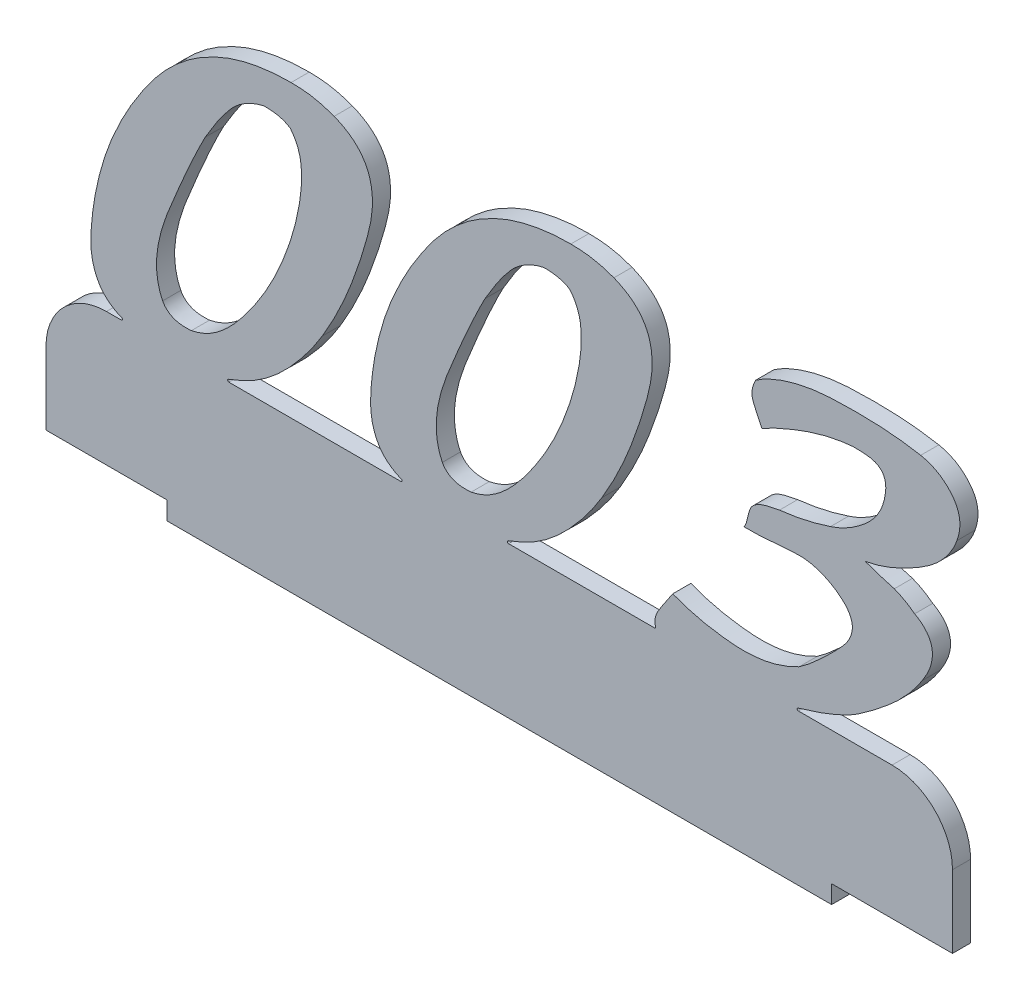
from build123d import *

# Parameters (mm, degrees)
BOSS_EXTRUDE1_DEPTH = 3
FILLET1_R           = 10
FILLET2_R           = 0.2


with BuildPart() as part:
    # Sketch1 → Boss-Extrude1 (new body)
    with BuildSketch(Plane.XY):
        with BuildLine():
            Line((129.670523122, 22.000000417), (150, 22.000001605))
            Line((150, 22.000001605), (150, 0))
            Line((150, 0), (130, 0))
            Line((130, 0), (130, -3))
            Line((130, -3), (20, -3))
            Line((20, -3), (20, 0))
            Line((20, 0), (0, 0))
            Line((0, 0), (0, 22.000000417))
            Line((0, 22.000000417), (13.730123376, 22.000000417))
            add(Edge.make_bspline(
                [(13.730123376, 22.000000417), (13.575367614, 22.044525504), (12.898278913, 22.247042715), (11.746224702, 22.652814025), (10.439839355, 23.502672245), (9.329876359, 24.521732787), (8.500002952, 25.799003635), (7.894520699, 27.270533835), (7.340896292, 29.635376017), (7.410528522, 31.555082592), (7.500870789, 32.869615858)],
                knots=[0.483401859, 0.483401859, 0.483401859, 0.483401859, 0.501387928, 0.562299825, 0.61931963, 0.674487907, 0.729675441, 0.788153341, 0.851799168, 1, 1, 1, 1], degree=3))
            add(Edge.make_bspline(
                [(7.500870789, 32.869615858), (7.667794855, 35.097712266), (8.156987725, 38.423285891), (9.286374198, 42.76009001), (10.349206593, 45.969453391), (11.703830036, 49.102790908), (13.24182826, 52.208620133), (15.049564789, 55.251769075), (17.056649865, 58.218903097), (19.254188301, 61.008251793), (21.728443108, 63.427065595), (24.370707541, 65.514697282), (27.250927796, 67.162088075), (30.286427791, 68.509929766), (34.708835469, 69.732258501), (38.187554324, 70.116972781), (40.554037326, 70.086191307)],
                knots=[0, 0, 0, 0, 0.122246067, 0.183381441, 0.245050885, 0.307031795, 0.37001055, 0.434578783, 0.500534692, 0.565957523, 0.628479512, 0.689453544, 0.749684058, 0.80955899, 0.870724503, 1, 1, 1, 1], degree=3))
            add(Edge.make_bspline(
                [(40.554037326, 70.086191307), (41.814276781, 70.075741454), (44.257116062, 69.932225522), (46.597269986, 69.222369727), (47.688517388, 68.815667461)],
                knots=[0, 0, 0, 0, 0.519885394, 1, 1, 1, 1], degree=3))
            add(Edge.make_bspline(
                [(47.688517388, 68.815667461), (48.956064802, 68.300369248), (50.75111746, 67.307019277), (52.490430126, 65.324107258), (53.399952218, 63.650633137), (53.9152348, 61.745714323), (54.080545775, 59.628668962), (53.887438337, 57.297900417), (53.138038072, 53.958492874), (51.859517726, 49.792064789), (49.558334115, 43.488485275), (47.361417932, 39.062207885), (45.694772275, 36.309803504)],
                knots=[0, 0, 0, 0, 0.111905612, 0.162582178, 0.212592743, 0.265416324, 0.321765959, 0.384451445, 0.45478123, 0.599580751, 0.738515281, 1, 1, 1, 1], degree=3))
            add(Edge.make_bspline(
                [(45.694772275, 36.309803504), (44.603288156, 34.452591221), (42.732990723, 31.882116735), (39.983639344, 28.759133625), (37.814944447, 26.689865792), (35.432512769, 24.882203335), (32.752788972, 23.386409225), (30.577515914, 22.502142272), (29.309902049, 22.081948897), (29.051713309, 22.000000417)],
                knots=[0, 0, 0, 0, 0.257859597, 0.380113614, 0.498337489, 0.61657684, 0.737567111, 0.865047578, 0.897489606, 0.897489606, 0.897489606, 0.897489606], degree=3))
            Line((29.051713309, 22.000000417), (60.016284454, 22.000000417))
            add(Edge.make_bspline(
                [(60.016284454, 22.000000417), (59.861528687, 22.044525505), (59.184439979, 22.247042707), (58.032385766, 22.652814027), (56.726000418, 23.502672244), (55.616037422, 24.521732787), (54.786164015, 25.799003635), (54.180681762, 27.270533835), (53.627057355, 29.635376017), (53.696689586, 31.555082592), (53.787031852, 32.869615858)],
                knots=[0.483401858, 0.483401858, 0.483401858, 0.483401858, 0.501387928, 0.562299825, 0.61931963, 0.674487907, 0.729675441, 0.788153341, 0.851799168, 1, 1, 1, 1], degree=3))
            add(Edge.make_bspline(
                [(53.787031852, 32.869615858), (53.953955919, 35.097712266), (54.443148789, 38.423285891), (55.572535261, 42.76009001), (56.635367656, 45.969453391), (57.989991099, 49.102790908), (59.527989323, 52.208620133), (61.335725853, 55.251769075), (63.342810928, 58.218903097), (65.540349365, 61.008251793), (68.014604171, 63.427065595), (70.656868605, 65.514697282), (73.537088859, 67.162088075), (76.572588855, 68.509929766), (80.994996532, 69.732258501), (84.473715388, 70.116972781), (86.840198389, 70.086191307)],
                knots=[0, 0, 0, 0, 0.122246067, 0.183381441, 0.245050885, 0.307031795, 0.37001055, 0.434578783, 0.500534692, 0.565957523, 0.628479512, 0.689453544, 0.749684058, 0.80955899, 0.870724503, 1, 1, 1, 1], degree=3))
            add(Edge.make_bspline(
                [(86.840198389, 70.086191307), (88.100437844, 70.075741454), (90.543277126, 69.932225522), (92.883431049, 69.222369727), (93.974678451, 68.815667461)],
                knots=[0, 0, 0, 0, 0.519885394, 1, 1, 1, 1], degree=3))
            add(Edge.make_bspline(
                [(93.974678451, 68.815667461), (95.242225865, 68.300369248), (97.037278523, 67.307019277), (98.776591189, 65.324107258), (99.686113282, 63.650633137), (100.201395864, 61.745714323), (100.366706838, 59.628668962), (100.173599401, 57.297900417), (99.424199135, 53.958492874), (98.145678789, 49.792064789), (95.844495178, 43.488485275), (93.647578996, 39.062207885), (91.980933338, 36.309803504)],
                knots=[0, 0, 0, 0, 0.111905612, 0.162582178, 0.212592743, 0.265416324, 0.321765959, 0.384451445, 0.45478123, 0.599580751, 0.738515281, 1, 1, 1, 1], degree=3))
            add(Edge.make_bspline(
                [(91.980933338, 36.309803504), (90.889449219, 34.452591221), (89.019151786, 31.882116735), (86.269800407, 28.759133625), (84.10110551, 26.689865792), (81.718673833, 24.882203335), (79.038950035, 23.386409225), (76.863676979, 22.502142272), (75.596063111, 22.081948897), (75.337874371, 22.000000417)],
                knots=[0, 0, 0, 0, 0.257859597, 0.380113614, 0.498337489, 0.61657684, 0.737567111, 0.865047578, 0.897489606, 0.897489606, 0.897489606, 0.897489606], degree=3))
            Line((75.337874371, 22.000000417), (100.96769877, 22.000000417))
            add(Edge.make_bspline(
                [(100.96769877, 22.000000417), (100.921774279, 22.101728329), (100.787984634, 22.478616927), (100.731337189, 23.212378303), (100.964458159, 24.18503168), (101.992200675, 25.930353866), (103.003412906, 27.27938947), (103.70884577, 28.393462613)],
                knots=[0.070480235, 0.070480235, 0.070480235, 0.070480235, 0.113448363, 0.224395637, 0.348056594, 0.492966758, 1, 1, 1, 1], degree=3))
            add(Edge.make_bspline(
                [(103.70884577, 28.393462613), (105.365020694, 27.753180242), (107.929577946, 26.973277877), (111.470107994, 26.392191328), (114.177759996, 26.094043902), (116.908694401, 26.104239346), (120.490249656, 26.593796405), (123.039219963, 27.54878063), (124.623622939, 28.393462613)],
                knots=[0, 0, 0, 0, 0.247124859, 0.371259261, 0.498795594, 0.625702225, 0.750177044, 1, 1, 1, 1], degree=3))
            add(Edge.make_bspline(
                [(124.623622939, 28.393462613), (125.707994947, 29.113582922), (127.319401766, 30.508140017), (129.575085069, 32.614741663), (131.171505631, 34.221154083), (132.39393609, 35.605752919), (133.045446244, 36.673829989), (133.398641946, 37.723146598), (133.475300082, 38.747702202), (133.213086793, 39.743401037), (132.435246266, 41.093081865), (131.45999588, 41.880960772), (130.761230445, 42.369224927)],
                knots=[0, 0, 0, 0, 0.209310503, 0.343078083, 0.497575291, 0.574369076, 0.640301696, 0.697766983, 0.751429678, 0.803400302, 0.861248312, 1, 1, 1, 1], degree=3))
            add(Edge.make_bspline(
                [(130.761230445, 42.369224927), (129.661463512, 43.126352434), (127.844417527, 43.991308054), (125.220963751, 44.435351446), (121.323370194, 44.23475102), (118.112179023, 43.819186982), (115.514944284, 43.893853544)],
                knots=[0, 0, 0, 0, 0.255382353, 0.37922334, 0.505212288, 1, 1, 1, 1], degree=3))
            add(Edge.make_bspline(
                [(115.514944284, 43.893853544), (115.817682279, 44.328571474), (116.081494753, 45.370519226), (116.296328894, 46.41340839), (116.511816841, 46.923564255)],
                knots=[0, 0, 0, 0, 0.485390366, 1, 1, 1, 1], degree=3))
            add(Edge.make_bspline(
                [(116.511816841, 46.923564255), (116.768174779, 47.610773861), (118.36461897, 48.731119811), (120.233953254, 49.019404928), (121.3789005, 49.2300537)],
                knots=[0, 0, 0, 0, 0.373077534, 1, 1, 1, 1], degree=3))
            add(Edge.make_bspline(
                [(121.3789005, 49.2300537), (125.70456551, 49.688686955), (129.822997451, 51.086973168)],
                knots=[0, 0, 0, 1, 1, 1], degree=2))
            add(Edge.make_bspline(
                [(129.822997451, 51.086973168), (130.880108033, 51.419648717), (132.431045209, 52.119965032), (134.349574855, 53.382689331), (135.75190741, 54.499415087), (137.002656235, 55.78211295), (138.311454471, 57.737915247), (138.800477758, 59.440468134), (138.931676106, 60.586582238)],
                knots=[0, 0, 0, 0, 0.239109959, 0.365172213, 0.495269351, 0.625647748, 0.750534367, 1, 1, 1, 1], degree=3))
            add(Edge.make_bspline(
                [(138.931676106, 60.586582238), (139.017286526, 61.386454926), (138.921104221, 62.734332357), (137.701138738, 63.869636045), (136.518292935, 64.263262897), (135.157588108, 64.394476089), (133.656829749, 64.457793049), (132.036927925, 64.26747235), (129.725715519, 63.882268402), (126.76469617, 63.096471093), (123.90365146, 62.034184664), (121.772499006, 61.11043595), (120.139348531, 60.401728504), (119.087295908, 59.822313046), (118.486015433, 59.452884036)],
                knots=[0, 0, 0, 0, 0.105860809, 0.151148094, 0.202066113, 0.259997274, 0.323222608, 0.390850349, 0.464934646, 0.618432313, 0.775800913, 0.848983913, 0.911074804, 1, 1, 1, 1], degree=3))
            add(Edge.make_bspline(
                [(118.486015433, 59.452884036), (118.010714563, 60.483677779), (117.314842223, 61.70623214), (116.799109761, 63.319015599), (116.822196727, 64.489196639), (117.137267576, 65.33140519), (117.430503315, 65.864142832)],
                knots=[0, 0, 0, 0, 0.496027357, 0.614229882, 0.73389997, 1, 1, 1, 1], degree=3))
            add(Edge.make_bspline(
                [(117.430503315, 65.864142832), (119.225536993, 67.09574524), (122.36825377, 68.376691735), (126.94194303, 69.345487048), (130.756371643, 69.617393093), (134.592803848, 69.663349464), (139.274908272, 69.528328226), (142.626643716, 69.158790587), (144.736992759, 68.757027899)],
                knots=[0, 0, 0, 0, 0.231433242, 0.359702201, 0.498957825, 0.639815328, 0.770265834, 1, 1, 1, 1], degree=3))
            add(Edge.make_bspline(
                [(144.736992759, 68.757027899), (145.776449187, 68.544742339), (147.291588553, 68.00111026), (148.978295745, 66.727759062), (150.051545522, 65.595782376), (150.855604769, 64.264612979), (151.418126509, 62.195565479), (151.115940104, 60.553302381), (150.73777462, 59.531070119)],
                knots=[0, 0, 0, 0, 0.252437657, 0.373944377, 0.498634879, 0.620593116, 0.739092813, 1, 1, 1, 1], degree=3))
            add(Edge.make_bspline(
                [(150.73777462, 59.531070119), (150.244298671, 58.123356153), (148.994070153, 56.149107654), (146.658137394, 53.953202765), (144.476342015, 52.51486202), (142.169993441, 51.269986544), (139.25523297, 49.914628438), (137.033326534, 49.227558935), (135.569674542, 48.975948931)],
                knots=[0, 0, 0, 0, 0.231687999, 0.359129433, 0.498309405, 0.638597779, 0.768407197, 1, 1, 1, 1], degree=3))
            add(Edge.make_bspline(
                [(135.569674542, 48.975948931), (136.446057804, 48.712532128), (138.014054718, 48.096551822), (139.641240612, 47.662866589), (140.378118639, 47.451320314)],
                knots=[0, 0, 0, 0, 0.543939758, 1, 1, 1, 1], degree=3))
            add(Edge.make_bspline(
                [(140.378118639, 47.451320314), (142.204337901, 46.746200127), (143.740120203, 45.535761284)],
                knots=[0, 0, 0, 1, 1, 1], degree=2))
            add(Edge.make_bspline(
                [(143.740120203, 45.535761284), (144.515353651, 45.134869669), (145.511455865, 44.34160973), (146.392638385, 42.962825568), (146.681395442, 41.852851873), (146.691602689, 40.656217147), (146.309638468, 38.816425354), (145.566107672, 37.503217021), (145.01064405, 36.622547836)],
                knots=[0, 0, 0, 0, 0.250144104, 0.357668588, 0.46435922, 0.57479225, 0.698847353, 1, 1, 1, 1], degree=3))
            add(Edge.make_bspline(
                [(145.01064405, 36.622547836), (144.190961137, 35.323337413), (142.731778849, 33.477023332), (140.47065832, 31.21405906), (138.586242991, 29.624055171), (136.762072077, 28.189325049), (134.81791762, 26.784794869), (133.484837143, 25.904723147), (132.657242955, 25.481031026)],
                knots=[0, 0, 0, 0, 0.274284974, 0.419249351, 0.571241075, 0.71478044, 0.834077755, 1, 1, 1, 1], degree=3))
            add(Edge.make_bspline(
                [(132.657242955, 25.481031026), (130.455644675, 24.398098651), (127.252409819, 23.194768009), (123.972000135, 22.249540717), (123.042271869, 22.000000417)],
                knots=[0, 0, 0, 0, 0.226937124, 0.316064822, 0.316064822, 0.316064822, 0.316064822], degree=3))
            Line((123.042271869, 22.000000417), (129.670523122, 22.000000417))
        make_face()
        with BuildLine():
            add(Edge.make_bspline(
                [(40.41721168, 63.479467304), (39.815951714, 63.888984454), (38.350663408, 64.39512865), (36.812867368, 64.522423785), (35.999697998, 64.476339861)],
                knots=[0, 0, 0, 0, 0.469698931, 1, 1, 1, 1], degree=3))
            add(Edge.make_bspline(
                [(35.999697998, 64.476339861), (34.854996726, 64.235651359), (33.236957818, 63.558123053), (31.348570874, 62.180557305), (29.040664196, 59.60249703), (27.506966433, 57.150912982), (26.363263283, 55.172195999)],
                knots=[0, 0, 0, 0, 0.252589616, 0.375811021, 0.503770371, 1, 1, 1, 1], degree=3))
            add(Edge.make_bspline(
                [(26.363263283, 55.172195999), (25.906984468, 54.374140244), (25.308764654, 53.057574619), (24.417251492, 51.238512259), (23.703783831, 49.65696431), (22.939402307, 47.937735826), (22.138915004, 46.071006982), (21.282316204, 44.07479888), (20.410252187, 41.986477172), (19.617263695, 39.888301177), (18.985607988, 37.860947991), (18.544802448, 35.953854287), (18.301900962, 34.160810443), (18.254587134, 32.481525913), (18.456291306, 30.455826707), (18.875799311, 29.032169355), (19.306969304, 28.178450885)],
                knots=[0, 0, 0, 0, 0.095871325, 0.150956838, 0.211549603, 0.277044413, 0.347448488, 0.423659813, 0.503898773, 0.583776288, 0.6578152, 0.725493304, 0.78794858, 0.846481479, 0.900510454, 1, 1, 1, 1], degree=3))
            add(Edge.make_bspline(
                [(19.306969304, 28.178450885), (19.665416145, 27.435433867), (21.164890201, 26.228158385), (23.077791248, 26.211570134), (24.056773838, 26.282438375)],
                knots=[0, 0, 0, 0, 0.446153942, 1, 1, 1, 1], degree=3))
            add(Edge.make_bspline(
                [(24.056773838, 26.282438375), (25.514298337, 26.556793584), (27.670893605, 27.575214149), (30.203195122, 29.742983681), (32.153657072, 31.900176259), (34.020456111, 34.385695431), (35.781981877, 37.059697227), (37.372430014, 39.886183825), (38.766957933, 42.842431826), (39.965108101, 45.859416285), (40.956643081, 48.871478134), (41.67532497, 51.859974988), (42.179862178, 54.750578336), (42.349478998, 57.452333592), (42.147612863, 60.482896757), (41.272766252, 62.471448221), (40.41721168, 63.479467304)],
                knots=[0, 0, 0, 0, 0.099522769, 0.157975555, 0.224341199, 0.295661745, 0.367825167, 0.440561069, 0.514605516, 0.588508481, 0.659789613, 0.728660389, 0.796041852, 0.857776262, 0.9112652, 1, 1, 1, 1], degree=3))
        make_face(mode=Mode.SUBTRACT)
        with BuildLine():
            add(Edge.make_bspline(
                [(86.703372744, 63.479467304), (86.102112777, 63.888984454), (84.636824471, 64.39512865), (83.099028432, 64.522423785), (82.285859061, 64.476339861)],
                knots=[0, 0, 0, 0, 0.469698931, 1, 1, 1, 1], degree=3))
            add(Edge.make_bspline(
                [(82.285859061, 64.476339861), (81.141157789, 64.235651359), (79.523118881, 63.558123053), (77.634731938, 62.180557305), (75.32682526, 59.60249703), (73.793127496, 57.150912982), (72.649424347, 55.172195999)],
                knots=[0, 0, 0, 0, 0.252589616, 0.375811021, 0.503770371, 1, 1, 1, 1], degree=3))
            add(Edge.make_bspline(
                [(72.649424347, 55.172195999), (72.193145531, 54.374140244), (71.594925717, 53.057574619), (70.703412556, 51.238512259), (69.989944894, 49.65696431), (69.22556337, 47.937735826), (68.425076067, 46.071006982), (67.568477268, 44.07479888), (66.696413251, 41.986477172), (65.903424759, 39.888301177), (65.271769051, 37.860947991), (64.830963511, 35.953854287), (64.588062026, 34.160810443), (64.540748198, 32.481525913), (64.742452369, 30.455826707), (65.161960375, 29.032169355), (65.593130367, 28.178450885)],
                knots=[0, 0, 0, 0, 0.095871325, 0.150956838, 0.211549603, 0.277044413, 0.347448488, 0.423659813, 0.503898773, 0.583776288, 0.6578152, 0.725493304, 0.78794858, 0.846481479, 0.900510454, 1, 1, 1, 1], degree=3))
            add(Edge.make_bspline(
                [(65.593130367, 28.178450885), (65.951577208, 27.435433867), (67.451051264, 26.228158385), (69.363952311, 26.211570134), (70.342934902, 26.282438375)],
                knots=[0, 0, 0, 0, 0.446153942, 1, 1, 1, 1], degree=3))
            add(Edge.make_bspline(
                [(70.342934902, 26.282438375), (71.8004594, 26.556793584), (73.957054668, 27.575214149), (76.489356185, 29.742983681), (78.439818135, 31.900176259), (80.306617174, 34.385695431), (82.06814294, 37.059697227), (83.658591078, 39.886183825), (85.053118997, 42.842431826), (86.251269165, 45.859416285), (87.242804144, 48.871478134), (87.961486033, 51.859974988), (88.466023242, 54.750578336), (88.635640061, 57.452333592), (88.433773927, 60.482896757), (87.558927315, 62.471448221), (86.703372744, 63.479467304)],
                knots=[0, 0, 0, 0, 0.099522769, 0.157975555, 0.224341199, 0.295661745, 0.367825167, 0.440561069, 0.514605516, 0.588508481, 0.659789613, 0.728660389, 0.796041852, 0.857776262, 0.9112652, 1, 1, 1, 1], degree=3))
        make_face(mode=Mode.SUBTRACT)
    extrude(amount=BOSS_EXTRUDE1_DEPTH)

    # Fillet1
    fillet1_edges = [part.edges().sort_by_distance(p)[0] for p in [
        (150, 22.000001605, 1.5),
        (0, 22.000000417, 1.5),
    ]]
    fillet(fillet1_edges, radius=FILLET1_R)

    # Fillet2
    fillet2_edges = [part.edges().sort_by_distance(p)[0] for p in [
        (13.730123376, 22.000000417, 1.5),
        (60.016284454, 22.000000417, 1.5),
        (100.96769877, 22.000000417, 1.5),
        (123.042271869, 22.000000417, 1.5),
        (75.337874371, 22.000000417, 1.5),
        (29.051713309, 22.000000417, 1.5),
    ]]
    fillet(fillet2_edges, radius=FILLET2_R)


solid = part.part
